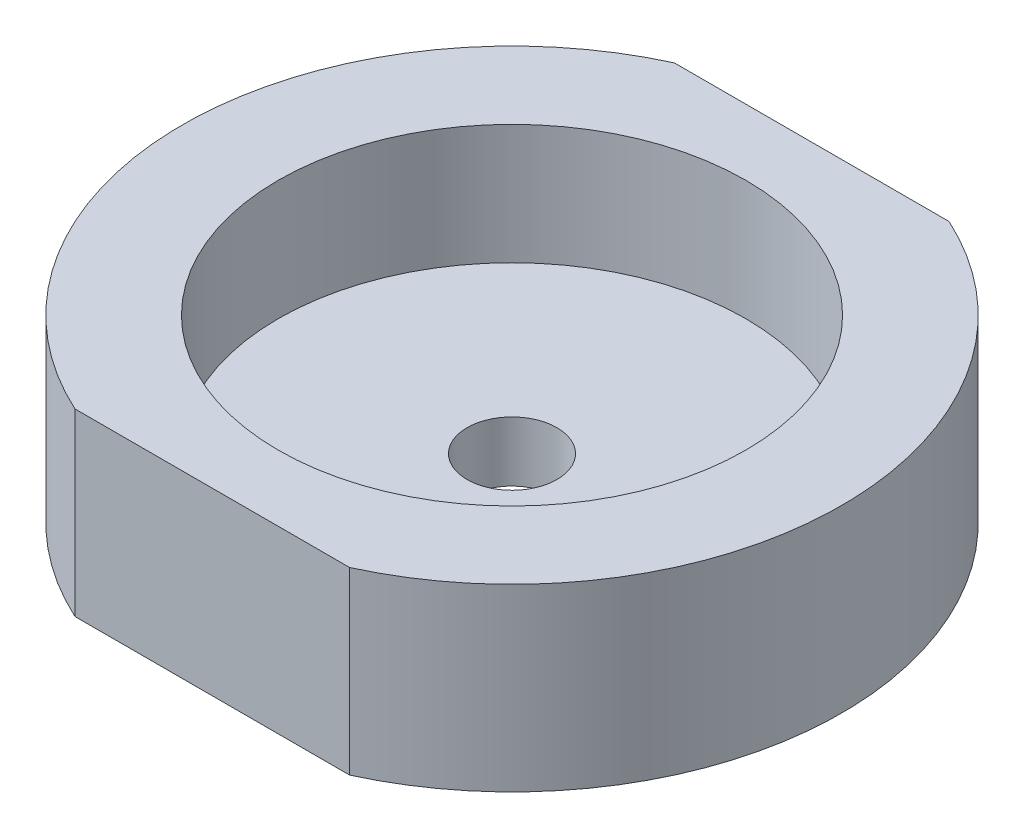
from build123d import *

# Parameters (mm, degrees)
SKETCH_1_R          = 5
EXTRUDE_1_DEPTH     = 3
SKETCH_2_R          = 3.9
CUT_EXTRUDE_1_DEPTH = 2
SKETCH_3_R          = 0.75
CUT_EXTRUDE_2_DEPTH = 8.697402159


with BuildPart() as part:
    # 草图1 → 凸台-拉伸1 (new body)
    with BuildSketch(Plane(origin=(0, 0, 0), x_dir=(1, 0, 0), z_dir=(0, 1, 0))):
        with BuildLine():
            ThreePointArc((-2.291287847, 5), (-5.5, 0), (-2.291287847, -5))
            Line((-2.291287847, -5), (0, -5))
            ThreePointArc((0, -5), (-5, 0), (0, 5))
            Line((0, 5), (-2.291287847, 5))
        make_face()
        with BuildLine():
            ThreePointArc((5, 0), (3.535533906, -3.535533906), (0, -5))
            Line((0, -5), (2.291287847, -5))
            ThreePointArc((2.291287847, -5), (4.628827236, -2.970514841), (5.5, 0))
            ThreePointArc((5.5, 0), (4.628827236, 2.970514841), (2.291287847, 5))
            Line((2.291287847, 5), (0, 5))
            ThreePointArc((0, 5), (3.535533906, 3.535533906), (5, 0))
        make_face()
        Circle(SKETCH_1_R)
    extrude(amount=EXTRUDE_1_DEPTH)

    # 草图2 → 切除-拉伸1 (cut)
    with BuildSketch(Plane(origin=(0, 3, 0), x_dir=(1, 0, 0), z_dir=(0, 1, 0))):
        with Locations(Location((0, 0, 0), (0, 0, 270))):
            Circle(SKETCH_2_R)
    extrude(amount=-CUT_EXTRUDE_1_DEPTH, mode=Mode.SUBTRACT)

    # 草图3 → 切除-拉伸2 (cut, through all)
    with BuildSketch(Plane(origin=(0, 1, 0), x_dir=(-1, 0, 0), z_dir=(0, -1, 0))):
        with Locations(Location((0, 0, 0), (0, 0, 90))):
            Circle(SKETCH_3_R)
    extrude(amount=CUT_EXTRUDE_2_DEPTH, mode=Mode.SUBTRACT)


solid = part.part
